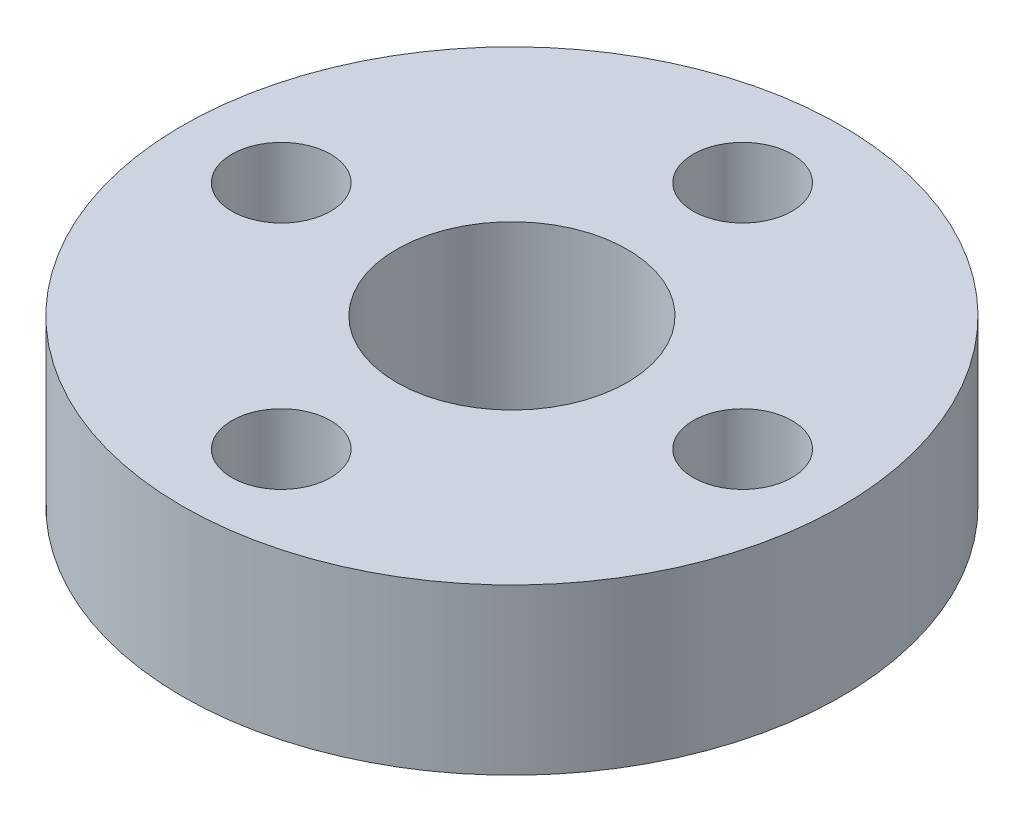
from build123d import *

# Parameters (mm, degrees)
SKETCH_1_R      = 10
SKETCH_1_R_2    = 1.5
SKETCH_1_R_3    = 3.5
EXTRUDE_1_DEPTH = 5


with BuildPart() as part:
    # 草图1 → 凸台-拉伸1 (new body)
    with BuildSketch(Plane(origin=(0, 0, 0), x_dir=(1, 0, 0), z_dir=(0, 1, 0))):
        with Locations(Location((0, 0, 0), (0, 0, 270))):
            Circle(SKETCH_1_R)
        with Locations(Location((0, 7, 0), (0, 0, 270))):
            Circle(SKETCH_1_R_2, mode=Mode.SUBTRACT)
        with Locations(Location((7, 0, 0), (0, 0, 270))):
            Circle(SKETCH_1_R_2, mode=Mode.SUBTRACT)
        with Locations(Location((0, 0, 0), (0, 0, 270))):
            Circle(SKETCH_1_R_3, mode=Mode.SUBTRACT)
        with Locations(Location((0, -7, 0), (0, 0, 90))):
            Circle(SKETCH_1_R_2, mode=Mode.SUBTRACT)
        with Locations(Location((-7, 0, 0), (0, 0, 90))):
            Circle(SKETCH_1_R_2, mode=Mode.SUBTRACT)
    extrude(amount=EXTRUDE_1_DEPTH)


solid = part.part
